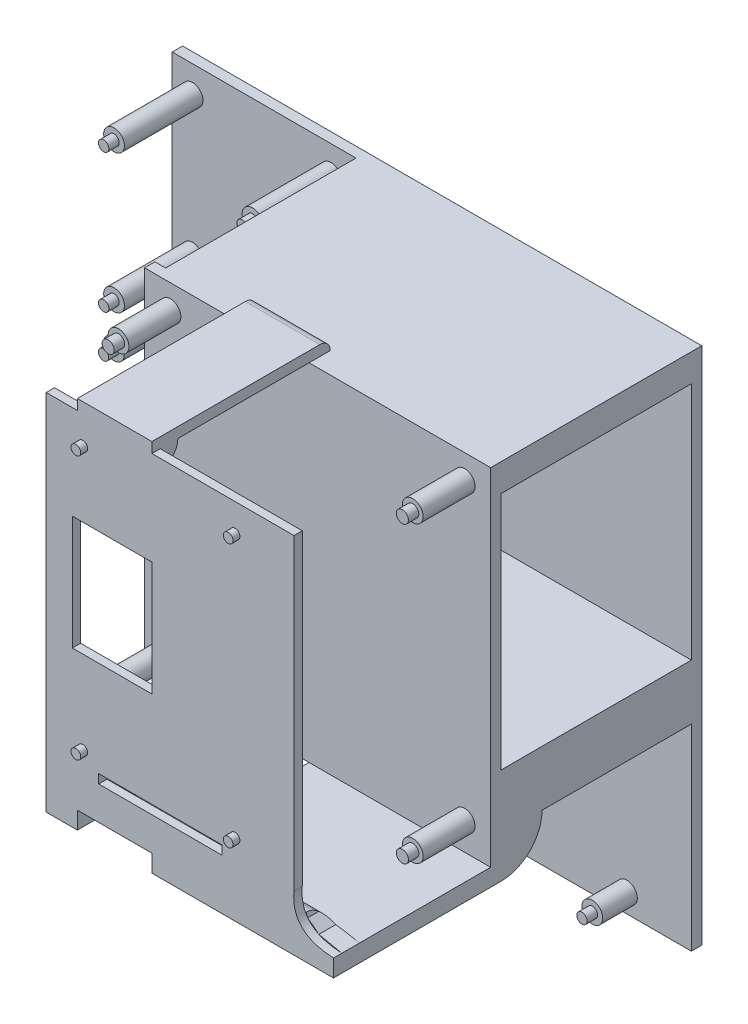
from build123d import *

# Parameters (mm, degrees)
SKETCH1_W            = 150
SKETCH1_H            = 150
BOSS_EXTRUDE2_DEPTH  = 3
SKETCH7_R            = 3
BOSS_EXTRUDE3_DEPTH  = 13
SKETCH13_W           = 15.146104274
SKETCH13_H           = 8
BOSS_EXTRUDE4_DEPTH  = 55
SKETCH14_W           = 100
SKETCH14_H           = 100
BOSS_EXTRUDE5_DEPTH  = 3
SKETCH15_R           = 3.001760758
SKETCH15_R_2         = 3.00141088
SKETCH15_R_3         = 3.000339641
SKETCH15_R_4         = 2.9990493
BOSS_EXTRUDE22_DEPTH = 15
SKETCH20_R           = 3
BOSS_EXTRUDE8_DEPTH  = 22.7
SKETCH23_W           = 52.466562125
SKETCH23_H           = 3
SKETCH23_W_2         = 9
BOSS_EXTRUDE9_DEPTH  = 5
BOSS_EXTRUDE10_DEPTH = 52.47
BOSS_EXTRUDE11_START = -74
BOSS_EXTRUDE11_DEPTH = 9
SKETCH25_W           = 9.00183775
SKETCH25_H           = 11.837712984
BOSS_EXTRUDE12_DEPTH = 8
SKETCH26_W           = 9
SKETCH26_H           = 5
SKETCH26_W_2         = 52.466562125
BOSS_EXTRUDE13_DEPTH = 43
SKETCH27_R           = 1.4
SKETCH27_W           = 35.7
SKETCH27_H           = 2.6
SKETCH27_W_2         = 23
SKETCH27_H_2         = 33
BOSS_EXTRUDE14_DEPTH = 2.4
SKETCH29_W           = 21.53
SKETCH29_H           = 48.531461908
BOSS_EXTRUDE15_DEPTH = 3
BOSS_EXTRUDE16_DEPTH = 21.53
BOSS_EXTRUDE17_DEPTH = 9
BOSS_EXTRUDE18_START = -30.53
BOSS_EXTRUDE18_DEPTH = 52.47
CUT_EXTRUDE5_DEPTH   = 8
BOSS_EXTRUDE19_DEPTH = 21.53
SKETCH21_R           = 1.5
BOSS_EXTRUDE20_DEPTH = 3
SKETCH17_R           = 1.5
BOSS_EXTRUDE21_DEPTH = 3
SKETCH15_3_R         = 1.75230345
SKETCH15_3_R_2       = 1.749240596
SKETCH15_3_R_3       = 1.752045419
SKETCH15_3_R_4       = 1.747263247
BOSS_EXTRUDE23_DEPTH = 18
SKETCH27_3_R         = 1.4
BOSS_EXTRUDE24_DEPTH = 4.4


with BuildPart() as part:
    # Sketch1 → Boss-Extrude2 (new body)
    with BuildSketch(Plane.XY):
        with Locations((121.156017968, 146.961713176)):
            Rectangle(SKETCH1_W, SKETCH1_H)
    extrude(amount=BOSS_EXTRUDE2_DEPTH)

    # Sketch7 → Boss-Extrude3 (add)
    with BuildSketch(Plane.XY):
        with Locations(Location((100.23733205, 77.422228763, 0), (0, 0, 180))):
            Circle(SKETCH7_R)
        with Locations(Location((177.53733205, 77.422228763, 0), (0, 0, 180))):
            Circle(SKETCH7_R)
        with Locations(Location((177.53733205, 119.222228763, 0), (0, 0, 180))):
            Circle(SKETCH7_R)
        with Locations(Location((100.23733205, 119.222228763, 0), (0, 0, 180))):
            Circle(SKETCH7_R)
    extrude(amount=BOSS_EXTRUDE3_DEPTH)

    # Sketch13 → Boss-Extrude4 (add)
    with BuildSketch(Plane.XY.offset(3)):
        Polygon((196.156017968, 213.964413798), (196.156017968, 221.961713176), (99.253187126, 221.961713176), (99.253187126, 213.964413798), (107.253187126, 213.964413798), align=None)
        Polygon((107.253187126, 213.964413798), (99.253187126, 213.964413798), (99.253187126, 126.654100723), (107.253187126, 126.654100723), (107.253187126, 136.806372616), (107.253187126, 144.806372616), align=None)
        Polygon((196.156017968, 136.806372616), (196.156017968, 144.806372616), (107.253187126, 144.806372616), (107.253187126, 136.806372616), (181.009913694, 136.806372616), align=None)
        with Locations((188.582965831, 132.806372616)):
            Rectangle(SKETCH13_W, SKETCH13_H)
    extrude(amount=BOSS_EXTRUDE4_DEPTH)

    # Sketch14 → Boss-Extrude5 (add)
    with BuildSketch(Plane.XY.offset(58)):
        with Locations((146.156017968, 171.961713176)):
            Rectangle(SKETCH14_W, SKETCH14_H)
    extrude(amount=BOSS_EXTRUDE5_DEPTH)

    # Sketch15 → Boss-Extrude22 (add)
    with BuildSketch(Plane.XY.offset(61)):
        with Locations(Location((103.656017968, 214.961713176, 0), (0, 0, 180))):
            Circle(SKETCH15_R)
        with Locations(Location((103.656017968, 129.961713176, 0), (0, 0, 180))):
            Circle(SKETCH15_R_2)
        with Locations(Location((188.656017968, 129.961713176, 0), (0, 0, 180))):
            Circle(SKETCH15_R_3)
        with Locations(Location((188.656017968, 214.961713176, 0), (0, 0, 180))):
            Circle(SKETCH15_R_4)
    extrude(amount=BOSS_EXTRUDE22_DEPTH)

    # Sketch20 → Boss-Extrude8 (add)
    with BuildSketch(Plane.XY.offset(3)):
        with Locations(Location((92.052701123, 214.281671575, 0), (0, 0, 180))):
            Circle(SKETCH20_R)
        with Locations(Location((52.052701123, 214.281671575, 0), (0, 0, 180))):
            Circle(SKETCH20_R)
        with Locations(Location((52.052701123, 174.281671575, 0), (0, 0, 180))):
            Circle(SKETCH20_R)
        with Locations(Location((92.052701123, 174.281671575, 0), (0, 0, 180))):
            Circle(SKETCH20_R)
        with Locations(Location((92.005217403, 161.997286282, 0), (0, 0, 180))):
            Circle(SKETCH20_R)
        with Locations(Location((52.005217403, 161.997286282, 0), (0, 0, 180))):
            Circle(SKETCH20_R)
        with Locations(Location((92.005217403, 121.997286282, 0), (0, 0, 180))):
            Circle(SKETCH20_R)
        with Locations(Location((52.005217403, 121.997286282, 0), (0, 0, 180))):
            Circle(SKETCH20_R)
    extrude(amount=BOSS_EXTRUDE8_DEPTH)

    # Sketch23 → Boss-Extrude9 (add)
    with BuildSketch(Plane.XZ.offset(-121.961713176)):
        with Locations((169.922736906, 59.5)):
            Rectangle(SKETCH23_W, SKETCH23_H)
        with Locations((117.656017968, 59.5)):
            Rectangle(SKETCH23_W_2, SKETCH23_H)
    extrude(amount=BOSS_EXTRUDE9_DEPTH)

    # Sketch24 → Boss-Extrude10 (add)
    with BuildSketch(Plane(origin=(196.156017968, 0, 0), x_dir=(0, 0, -1), z_dir=(1, 0, 0))):
        with BuildLine():
            Line((-58, 116.961713176), (-58, 128.806372616))
            Line((-58, 128.806372616), (-46.155340559, 128.806372616))
            ThreePointArc((-46.155340559, 128.806372616), (-49.624560989, 120.430933605), (-58, 116.961713176))
        make_face()
    extrude(amount=-BOSS_EXTRUDE10_DEPTH)

    # Sketch24<2> → Boss-Extrude11 (add)
    with BuildSketch(Plane(origin=(196.156017968, 0, 0), x_dir=(0, 0, -1), z_dir=(1, 0, 0)).offset(BOSS_EXTRUDE11_START)):
        with BuildLine():
            ThreePointArc((-58, 116.961713176), (-49.624560989, 120.430933605), (-46.155340559, 128.806372616))
            Line((-46.155340559, 128.806372616), (-58, 128.806372616))
            Line((-58, 128.806372616), (-58, 116.961713176))
        make_face()
    extrude(amount=-BOSS_EXTRUDE11_DEPTH)

    # Sketch25 → Boss-Extrude12 (add)
    with BuildSketch(Plane.XZ.offset(-136.806372616)):
        with Locations((117.656936843, 52.081143508)):
            Rectangle(SKETCH25_W, SKETCH25_H)
    extrude(amount=BOSS_EXTRUDE12_DEPTH)

    # Sketch26 → Boss-Extrude13 (add)
    with BuildSketch(Plane.XY.offset(61)):
        with Locations((117.656017968, 119.461713176)):
            Rectangle(SKETCH26_W, SKETCH26_H)
        with Locations((169.922736906, 119.461713176)):
            Rectangle(SKETCH26_W_2, SKETCH26_H)
    extrude(amount=BOSS_EXTRUDE13_DEPTH)

    # Sketch27 → Boss-Extrude14 (add)
    with BuildSketch(Plane.XY.offset(104)):
        with BuildLine():
            Line((113.156017968, 221.961713176), (113.156017968, 116.961713176))
            Line((113.156017968, 116.961713176), (122.156017968, 116.961713176))
            Line((122.156017968, 116.961713176), (122.156017968, 121.961713176))
            Line((122.156017968, 121.961713176), (143.689455843, 121.961713176))
            Line((143.689455843, 121.961713176), (143.689455843, 116.961713176))
            Line((143.689455843, 116.961713176), (196.156017968, 116.961713176))
            Line((196.156017968, 116.961713176), (196.156017968, 121.961713176))
            add(Edge.make_bspline(
                [(196.156017968, 121.961713176), (183.802165041, 122.519707419), (184.728927285, 132.962052817)],
                knots=[0, 0, 0, 1, 1, 1], degree=2))
            Line((184.728927285, 132.962052817), (184.728927285, 221.961713176))
            Line((184.728927285, 221.961713176), (113.156017968, 221.961713176))
        make_face()
        with Locations((123.722051557, 137.797431656)):
            Circle(SKETCH27_R, mode=Mode.SUBTRACT)
        with Locations((146.156017968, 132.877431656)):
            Rectangle(SKETCH27_W, SKETCH27_H, mode=Mode.SUBTRACT)
        with Locations((167.722051557, 137.797431656)):
            Circle(SKETCH27_R, mode=Mode.SUBTRACT)
        with Locations((132.189455843, 178.297431656)):
            Rectangle(SKETCH27_W_2, SKETCH27_H_2, mode=Mode.SUBTRACT)
        with Locations((123.722051557, 213.87831574)):
            Circle(SKETCH27_R, mode=Mode.SUBTRACT)
        with Locations((167.722051557, 213.87831574)):
            Circle(SKETCH27_R, mode=Mode.SUBTRACT)
    extrude(amount=BOSS_EXTRUDE14_DEPTH)

    # Sketch29 → Boss-Extrude15 (add)
    with BuildSketch(Plane(origin=(0, 221.961713176, 0), x_dir=(1, 0, 0), z_dir=(0, 1, 0))):
        with Locations((132.921017968, -82.134269046)):
            Rectangle(SKETCH29_W, SKETCH29_H)
    extrude(amount=BOSS_EXTRUDE15_DEPTH)

    # Sketch30 → Boss-Extrude16 (add)
    with BuildSketch(Plane.ZY.offset(-122.156017968)):
        with BuildLine():
            Line((57.868538092, 224.961713176), (57.868538092, 221.961713176))
            Line((57.868538092, 221.961713176), (54.868538092, 221.961713176))
            ThreePointArc((54.868538092, 221.961713176), (55.747217748, 224.083033519), (57.868538092, 224.961713176))
        make_face()
    extrude(amount=-BOSS_EXTRUDE16_DEPTH)

    # Sketch31 → Boss-Extrude17 (add)
    with BuildSketch(Plane.ZY.offset(-113.156017968)):
        with BuildLine():
            Line((104, 121.961713176), (98.905674281, 121.961713176))
            ThreePointArc((98.905674281, 121.961713176), (100.397767738, 125.563945438), (104, 127.056038895))
            Line((104, 127.056038895), (104, 121.961713176))
        make_face()
    extrude(amount=-BOSS_EXTRUDE17_DEPTH)

    # Sketch31<3> → Boss-Extrude18 (add)
    with BuildSketch(Plane.ZY.offset(-113.156017968).offset(BOSS_EXTRUDE18_START)):
        with BuildLine():
            Line((104, 121.961713176), (98.905674281, 121.961713176))
            ThreePointArc((98.905674281, 121.961713176), (100.397767738, 125.563945438), (104, 127.056038895))
            Line((104, 127.056038895), (104, 121.961713176))
        make_face()
    extrude(amount=-BOSS_EXTRUDE18_DEPTH)

    # Sketch33 → Cut-Extrude5 (cut)
    with BuildSketch(Plane.XY.offset(104)):
        Polygon((196.156017968, 121.961713176), (189.528499082, 123.368575123), (186.307168563, 125.915180821), (185.797122977, 127.056038895), (196.156017968, 127.056038895), align=None)
    extrude(amount=-CUT_EXTRUDE5_DEPTH, mode=Mode.SUBTRACT)

    # Sketch32 → Boss-Extrude19 (add)
    with BuildSketch(Plane.ZY.offset(-122.156017968)):
        with BuildLine():
            Line((104, 221.961713176), (104, 216.871001578))
            ThreePointArc((104, 216.871001578), (100.400323308, 218.362036484), (98.909288402, 221.961713176))
            Line((98.909288402, 221.961713176), (104, 221.961713176))
        make_face()
    extrude(amount=-BOSS_EXTRUDE19_DEPTH)

    # Sketch21 → Boss-Extrude20 (add)
    with BuildSketch(Plane.XY.offset(25.7)):
        with Locations((52.005217403, 161.997286282)):
            Circle(SKETCH21_R)
        with Locations((92.005217403, 161.997286282)):
            Circle(SKETCH21_R)
        with Locations((92.005217403, 121.997286282)):
            Circle(SKETCH21_R)
        with Locations((52.005217403, 121.984897708)):
            Circle(SKETCH21_R)
        with Locations((52.052701123, 214.281671575)):
            Circle(SKETCH21_R)
        with Locations((92.052701123, 214.281671575)):
            Circle(SKETCH21_R)
        with Locations((92.052701123, 174.269283002)):
            Circle(SKETCH21_R)
        with Locations((52.052701123, 174.269283002)):
            Circle(SKETCH21_R)
    extrude(amount=BOSS_EXTRUDE20_DEPTH)

    # Sketch17 → Boss-Extrude21 (add)
    with BuildSketch(Plane.XY.offset(13)):
        with Locations((100.23733205, 119.222228763)):
            Circle(SKETCH17_R)
        with Locations((100.23733205, 77.422228763)):
            Circle(SKETCH17_R)
        with Locations((177.53733205, 77.422228763)):
            Circle(SKETCH17_R)
        with Locations((177.53733205, 119.222228763)):
            Circle(SKETCH17_R)
    extrude(amount=BOSS_EXTRUDE21_DEPTH)

    # Sketch15<3> → Boss-Extrude23 (add)
    with BuildSketch(Plane.XY.offset(61)):
        with Locations((103.656017968, 214.961713176)):
            Circle(SKETCH15_3_R)
        with Locations((103.656017968, 129.961713176)):
            Circle(SKETCH15_3_R_2)
        with Locations((188.656017968, 129.961713176)):
            Circle(SKETCH15_3_R_3)
        with Locations((188.656017968, 214.961713176)):
            Circle(SKETCH15_3_R_4)
    extrude(amount=BOSS_EXTRUDE23_DEPTH)

    # Sketch27<3> → Boss-Extrude24 (add)
    with BuildSketch(Plane.XY.offset(104)):
        with Locations((167.722051557, 137.797431656)):
            Circle(SKETCH27_3_R)
        with Locations((123.722051557, 137.797431656)):
            Circle(SKETCH27_3_R)
        with Locations((123.722051557, 213.87831574)):
            Circle(SKETCH27_3_R)
        with Locations((167.722051557, 213.87831574)):
            Circle(SKETCH27_3_R)
    extrude(amount=BOSS_EXTRUDE24_DEPTH)


solid = part.part
